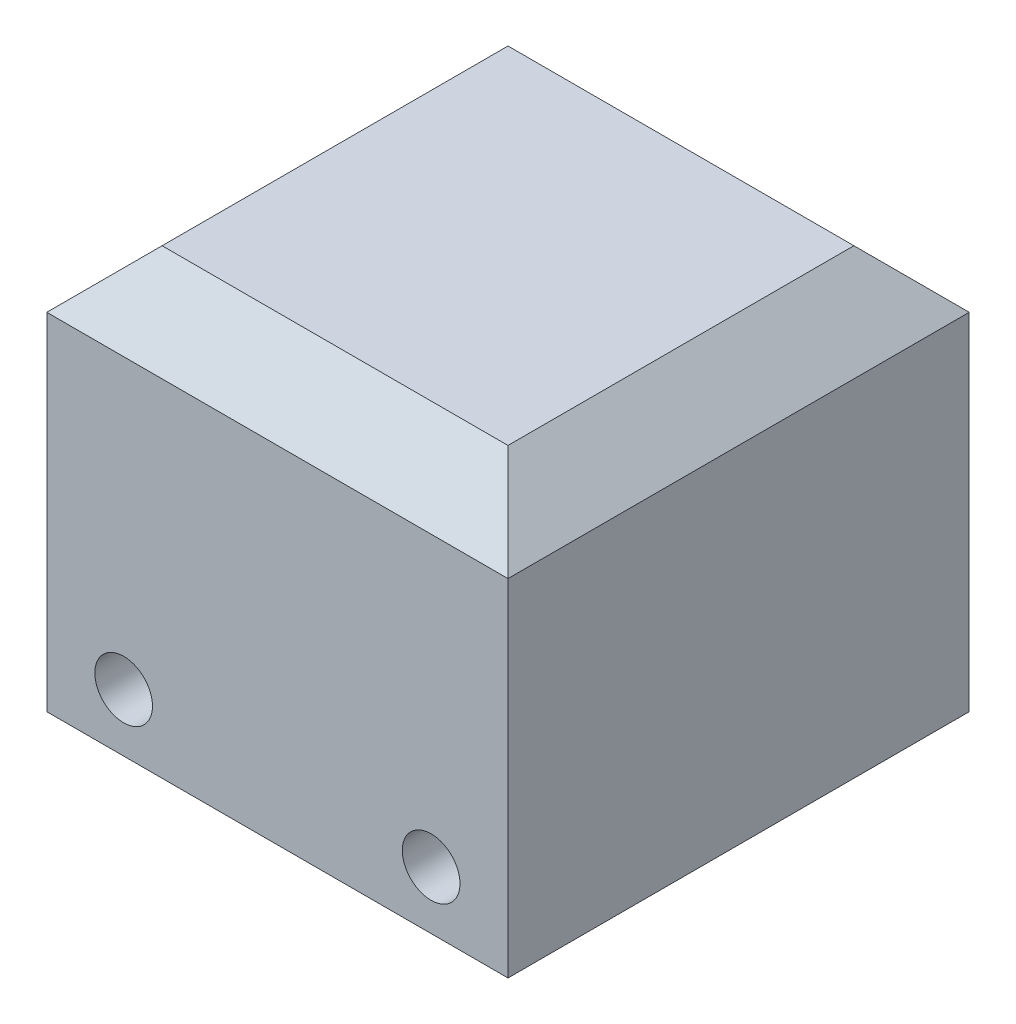
from build123d import *

# Parameters (mm, degrees)
BOSS_EXTRUDE1_DEPTH      = 38.1
BOSS_EXTRUDE1_DEPTH_BACK = 38.1
SKETCH1_W                = 76.2
SKETCH1_H                = 76.2
SKETCH1_R                = 4.7625
CHAMFER1_SIZE            = 9.525


with BuildPart() as part:
    # Sketch1 → Boss-Extrude1 (new, two sides: drawn at the far end of the back side and taken through both)
    with BuildSketch(Plane.XY.offset(-BOSS_EXTRUDE1_DEPTH_BACK)):
        with Locations((-6.35, -16.348197115)):
            Rectangle(SKETCH1_W, SKETCH1_H)
        with Locations((-31.75, -35.398197115)):
            Circle(SKETCH1_R, mode=Mode.SUBTRACT)
        with Locations((19.05, -35.398197115)):
            Circle(SKETCH1_R, mode=Mode.SUBTRACT)
    extrude(amount=BOSS_EXTRUDE1_DEPTH + BOSS_EXTRUDE1_DEPTH_BACK)

    # Chamfer1
    chamfer1_edges = [part.edges().sort_by_distance(p)[0] for p in [
        (-6.35, -54.448197115, -38.1),
        (-44.45, -54.448197115, 0),
        (-6.35, -54.448197115, 38.1),
        (31.75, -54.448197115, 0),
        (-6.35, 21.751802885, -38.1),
        (31.75, 21.751802885, 0),
        (-6.35, 21.751802885, 38.1),
        (-44.45, 21.751802885, 0),
    ]]
    chamfer(chamfer1_edges, length=CHAMFER1_SIZE)


solid = part.part
